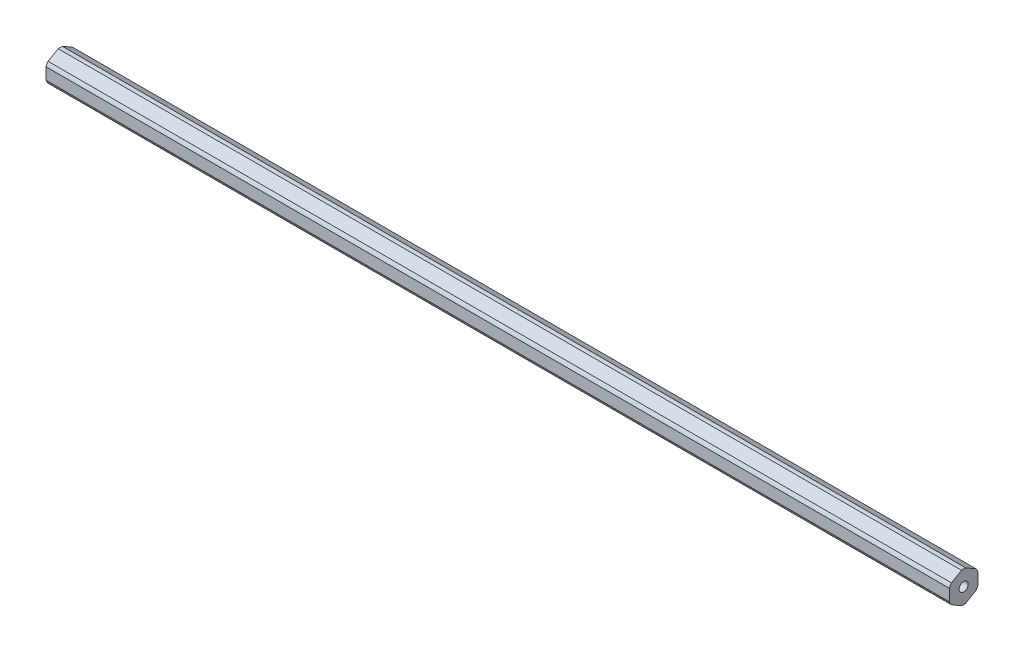
from build123d import *

# Parameters (mm, degrees)
BOSS_EXTRUDE1_DEPTH                  = 200.025
F_10_32_TAPPED_HOLE1_D               = 4.0386
F_10_32_TAPPED_HOLE1_DEPTH           = 16.34744
F_10_32_TAPPED_HOLE1_TIP             = 1.213317848
F_10_32_TAPPED_HOLE1_ON_FACE_2_D     = 4.0386
F_10_32_TAPPED_HOLE1_ON_FACE_2_DEPTH = 16.34744
F_10_32_TAPPED_HOLE1_ON_FACE_2_TIP   = 1.213317848


with BuildPart() as part:
    # Sketch1 → Boss-Extrude1 (new, symmetric)
    with BuildSketch(Plane(origin=(0, 0, 0), x_dir=(0, 0, -1), z_dir=(1, 0, 0))):
        with BuildLine():
            ThreePointArc((0.93173274, 6.79441227), (0, 6.858), (-0.93173274, 6.79441227))
            Line((-0.93173274, 6.79441227), (-5.41826726, 4.204110358))
            ThreePointArc((-5.41826726, 4.204110358), (-5.939202219, 3.429), (-6.35, 2.590301913))
            Line((-6.35, 2.590301913), (-6.35, -2.590301913))
            ThreePointArc((-6.35, -2.590301913), (-5.939202219, -3.429), (-5.41826726, -4.204110358))
            Line((-5.41826726, -4.204110358), (-0.93173274, -6.79441227))
            ThreePointArc((-0.93173274, -6.79441227), (0, -6.858), (0.93173274, -6.79441227))
            Line((0.93173274, -6.79441227), (5.41826726, -4.204110358))
            ThreePointArc((5.41826726, -4.204110358), (5.939202219, -3.429), (6.35, -2.590301913))
            Line((6.35, -2.590301913), (6.35, 2.590301913))
            ThreePointArc((6.35, 2.590301913), (5.939202219, 3.429), (5.41826726, 4.204110358))
            Line((5.41826726, 4.204110358), (0.93173274, 6.79441227))
        make_face()
    extrude(amount=BOSS_EXTRUDE1_DEPTH, both=True)

    # #10-32 Tapped Hole1
    with Locations(Plane(origin=(-200.025, 0, 0), x_dir=(0, 0, -1), z_dir=(-1, 0, 0))):
        with Locations((0, 0)):
            Hole(F_10_32_TAPPED_HOLE1_D / 2, depth=F_10_32_TAPPED_HOLE1_DEPTH)
            with Locations((0, 0, -(F_10_32_TAPPED_HOLE1_DEPTH + F_10_32_TAPPED_HOLE1_TIP / 2))):  # 118° drill point
                Cone(0, F_10_32_TAPPED_HOLE1_D / 2, F_10_32_TAPPED_HOLE1_TIP, mode=Mode.SUBTRACT)

    # #10-32 Tapped Hole1 on face 2
    with Locations(Plane(origin=(200.025, 0, 0), x_dir=(0, 0, 1), z_dir=(1, 0, 0))):
        with Locations((0, 0)):
            Hole(F_10_32_TAPPED_HOLE1_ON_FACE_2_D / 2, depth=F_10_32_TAPPED_HOLE1_ON_FACE_2_DEPTH)
            with Locations((0, 0, -(F_10_32_TAPPED_HOLE1_ON_FACE_2_DEPTH + F_10_32_TAPPED_HOLE1_ON_FACE_2_TIP / 2))):  # 118° drill point
                Cone(0, F_10_32_TAPPED_HOLE1_ON_FACE_2_D / 2, F_10_32_TAPPED_HOLE1_ON_FACE_2_TIP, mode=Mode.SUBTRACT)


solid = part.part
